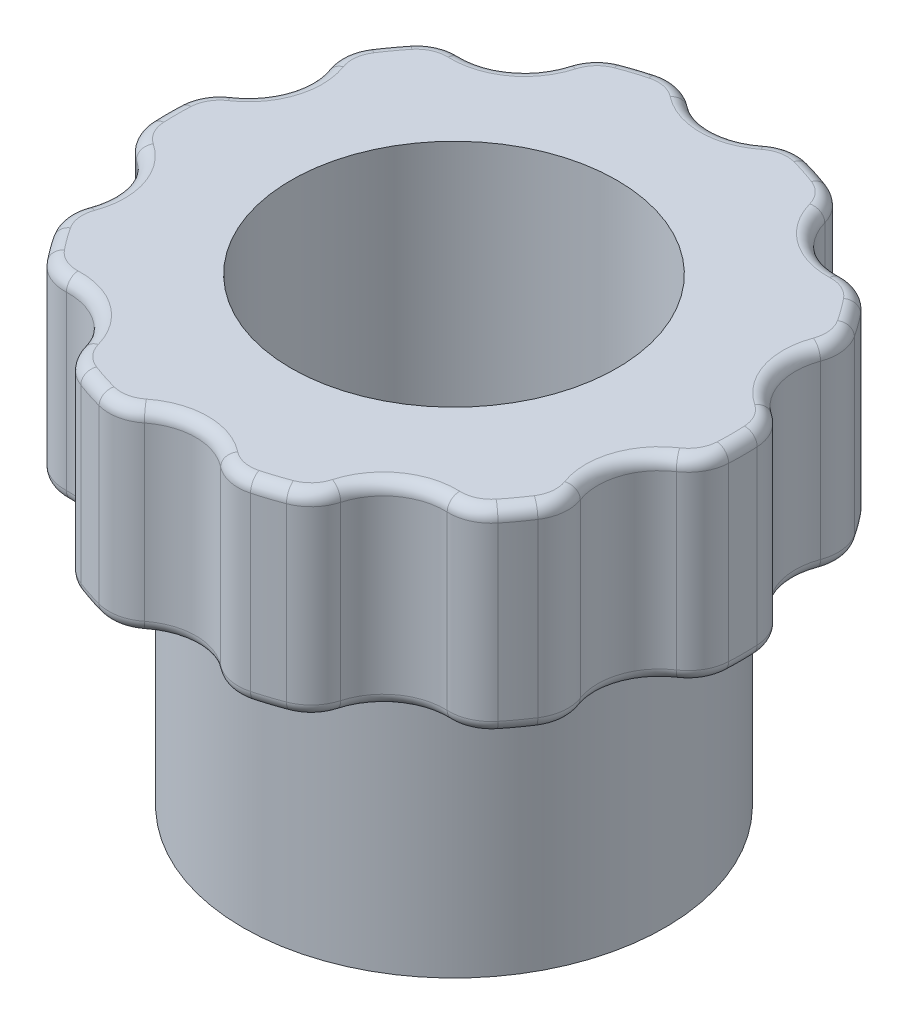
from build123d import *

# Parameters (mm, degrees)
SKETCH1_R           = 12.065
BOSS_EXTRUDE1_DEPTH = 19.2024
SKETCH3_R           = 6.7945
CUT_EXTRUDE1_DEPTH  = 19.2024
SKETCH4_R           = 2.564167807
CUT_EXTRUDE2_DEPTH  = 19.2024
CIRPATTERN1_COUNT   = 10
FILLET1_R           = 1.778
FILLET2_R           = 1.778
FILLET3_R           = 1.778
SKETCH6_R           = 12.715743381
SKETCH6_R_2         = 8.8011
CUT_EXTRUDE3_DEPTH  = 11.0236
FILLET4_R           = 0.508
FILLET5_R           = 0.508


with BuildPart() as part:
    # Sketch1 → Boss-Extrude1 (new body)
    with BuildSketch(Plane(origin=(0, 0, 0), x_dir=(1, 0, 0), z_dir=(0, 1, 0))):
        with Locations(Location((0, 0, 0), (0, 0, 270))):
            Circle(SKETCH1_R)
    extrude(amount=BOSS_EXTRUDE1_DEPTH)

    # Sketch3 → Cut-Extrude1 (cut)
    with BuildSketch(Plane(origin=(0, 0, 0), x_dir=(1, 0, 0), z_dir=(0, 1, 0))):
        with Locations(Location((0, 0, 0), (0, 0, 270))):
            Circle(SKETCH3_R)
    extrude(amount=CUT_EXTRUDE1_DEPTH, mode=Mode.SUBTRACT)

    # Sketch4 → Cut-Extrude2 (cut)
    with BuildSketch(Plane(origin=(0, 0, 0), x_dir=(1, 0, 0), z_dir=(0, 1, 0))):
        with Locations((0, 13.335)):
            Circle(SKETCH4_R)
    cut_extrude2 = extrude(amount=CUT_EXTRUDE2_DEPTH, mode=Mode.SUBTRACT)

    # CirPattern1: Cut-Extrude2 ×10 about axis
    cirpattern1_axis = Axis((0, 0, 0), (0, 1, 0))
    for i in range(1, CIRPATTERN1_COUNT):
        add(cut_extrude2.rotate(cirpattern1_axis, i * 360 / CIRPATTERN1_COUNT), mode=Mode.SUBTRACT)

    # Fillet1
    fillet1_edges = [part.edges().sort_by_distance(p)[0] for p in [
        (8.689824955, 9.6012, 8.369657535),
        (10.645320927, 9.6012, 5.678148233),
    ]]
    fillet(fillet1_edges, radius=FILLET1_R)

    # Fillet2
    fillet2_edges = [part.edges().sort_by_distance(p)[0] for p in [
        (-2.110654801, 9.6012, -11.878946136),
        (-5.274713749, 9.6012, -10.850881064),
        (-8.689824955, 9.6012, -8.369657535),
        (-10.645320927, 9.6012, -5.678148233),
        (-11.949777332, 9.6012, -1.66344423),
        (-11.949777332, 9.6012, 1.66344423),
        (-10.645320927, 9.6012, 5.678148233),
        (-8.689824955, 9.6012, 8.369657535),
        (-5.274713749, 9.6012, 10.850881064),
        (-2.110654801, 9.6012, 11.878946136),
        (2.110654801, 9.6012, 11.878946136),
        (5.274713749, 9.6012, 10.850881064),
    ]]
    fillet(fillet2_edges, radius=FILLET2_R)

    # Fillet3
    fillet3_edges = [part.edges().sort_by_distance(p)[0] for p in [
        (2.110654801, 9.6012, -11.878946136),
        (11.949777332, 9.6012, 1.66344423),
        (11.949777332, 9.6012, -1.66344423),
        (10.645320927, 9.6012, -5.678148233),
        (8.689824955, 9.6012, -8.369657535),
        (5.274713749, 9.6012, -10.850881064),
    ]]
    fillet(fillet3_edges, radius=FILLET3_R)

    # Sketch6 → Cut-Extrude3 (cut)
    with BuildSketch(Plane(origin=(0, 0, 0), x_dir=(1, 0, 0), z_dir=(0, 1, 0))):
        Circle(SKETCH6_R)
        with Locations(Location((0, 0, 0), (0, 0, 270))):
            Circle(SKETCH6_R_2, mode=Mode.SUBTRACT)
    extrude(amount=CUT_EXTRUDE3_DEPTH, mode=Mode.SUBTRACT)

    # Fillet4
    fillet4_edges = [part.edges().sort_by_distance(p)[0] for p in [
        (6.330936318, 19.2024, 8.713786288),
        (9.760790037, 19.2024, 7.091629069),
        (10.377269622, 19.2024, 5.827722759),
        (8.749246374, 19.2024, 8.068504525),
        (0, 19.2024, -10.770832193),
        (-3.728290037, 19.2024, -11.474496869),
        (-6.330936318, 19.2024, -8.713786288),
        (-9.760790037, 19.2024, -7.091629069),
        (-10.243670143, 19.2024, -3.328370191),
        (-12.065, 19.2024, 0),
        (-10.243670143, 19.2024, 3.328370191),
        (-9.760790037, 19.2024, 7.091629069),
        (-6.330936318, 19.2024, 8.713786288),
        (-3.728290037, 19.2024, 11.474496869),
        (0, 19.2024, 10.770832193),
        (3.728290037, 19.2024, 11.474496869),
        (4.969937988, 19.2024, 10.814332794),
        (2.335741037, 19.2024, 11.670235267),
        (-2.335741037, 19.2024, 11.670235267),
        (-4.969937988, 19.2024, 10.814332794),
        (-8.749246374, 19.2024, 8.068504525),
        (-10.377269622, 19.2024, 5.827722759),
        (-11.820836972, 19.2024, 1.384879293),
        (-11.820836972, 19.2024, -1.384879293),
        (-10.377269622, 19.2024, -5.827722759),
        (-8.749246374, 19.2024, -8.068504525),
        (-4.969937988, 19.2024, -10.814332794),
        (-2.335741037, 19.2024, -11.670235267),
        (3.728290037, 19.2024, -11.474496869),
        (10.243670143, 19.2024, 3.328370191),
        (12.065, 19.2024, 0),
        (10.243670143, 19.2024, -3.328370191),
        (9.760790037, 19.2024, -7.091629069),
        (6.330936318, 19.2024, -8.713786288),
        (8.749246374, 19.2024, -8.068504525),
        (10.377269622, 19.2024, -5.827722759),
        (11.820836972, 19.2024, -1.384879293),
        (11.820836972, 19.2024, 1.384879293),
        (4.969937988, 19.2024, -10.814332794),
        (2.335741037, 19.2024, -11.670235267),
    ]]
    fillet(fillet4_edges, radius=FILLET4_R)

    # Fillet5
    fillet5_edges = [part.edges().sort_by_distance(p)[0] for p in [
        (8.749246374, 11.0236, -8.068504525),
        (-6.330936318, 11.0236, 8.713786288),
        (-8.749246374, 11.0236, 8.068504525),
        (-10.377269622, 11.0236, 5.827722759),
        (-10.243670143, 11.0236, 3.328370191),
        (-11.820836972, 11.0236, 1.384879293),
        (-11.820836972, 11.0236, -1.384879293),
        (-10.243670143, 11.0236, -3.328370191),
        (-10.377269622, 11.0236, -5.827722759),
        (-8.749246374, 11.0236, -8.068504525),
        (-6.330936318, 11.0236, -8.713786288),
        (-4.969937988, 11.0236, -10.814332794),
        (-2.335741037, 11.0236, -11.670235267),
        (0, 11.0236, -10.770832193),
        (2.335741037, 11.0236, -11.670235267),
        (4.969937988, 11.0236, -10.814332794),
        (6.330936318, 11.0236, -8.713786288),
        (10.377269622, 11.0236, -5.827722759),
        (10.243670143, 11.0236, -3.328370191),
        (11.820836972, 11.0236, -1.384879293),
        (11.820836972, 11.0236, 1.384879293),
        (10.243670143, 11.0236, 3.328370191),
        (10.377269622, 11.0236, 5.827722759),
        (8.749246374, 11.0236, 8.068504525),
        (6.330936318, 11.0236, 8.713786288),
        (4.969937988, 11.0236, 10.814332794),
        (2.335741037, 11.0236, 11.670235267),
        (0, 11.0236, 10.770832193),
        (-2.335741037, 11.0236, 11.670235267),
        (-4.969937988, 11.0236, 10.814332794),
        (-3.728290037, 11.0236, 11.474496869),
        (3.728290037, 11.0236, 11.474496869),
        (9.760790037, 11.0236, 7.091629069),
        (12.065, 11.0236, 0),
        (9.760790037, 11.0236, -7.091629069),
        (3.728290037, 11.0236, -11.474496869),
        (-3.728290037, 11.0236, -11.474496869),
        (-9.760790037, 11.0236, -7.091629069),
        (-12.065, 11.0236, 0),
        (-9.760790037, 11.0236, 7.091629069),
    ]]
    fillet(fillet5_edges, radius=FILLET5_R)


solid = part.part
